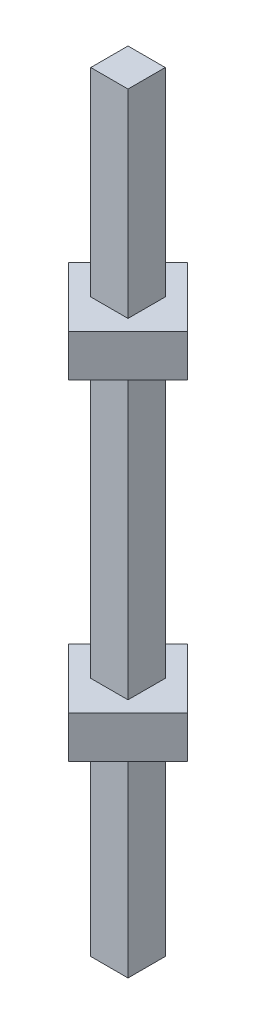
from build123d import *

# Parameters (mm, degrees)
SKETCH_1_W      = 15
SKETCH_1_H      = 15
EXTRUDE_1_DEPTH = 310
EXTRUDE_3_DEPTH = 17
EXTRUDE_4_DEPTH = 17


with BuildPart() as part:
    # 草图1 → 凸台-拉伸1 (new body)
    with BuildSketch(Plane(origin=(0, 0, 0), x_dir=(1, 0, 0), z_dir=(0, 1, 0))):
        with Locations((7.5, 7.5)):
            Rectangle(SKETCH_1_W, SKETCH_1_H)
    extrude(amount=EXTRUDE_1_DEPTH)

    # 草图3 → 凸台-拉伸3 (add)
    with BuildSketch(Plane(origin=(0, 80, 0), x_dir=(-1, 0, 0), z_dir=(0, -1, 0))):
        Polygon((-7.5, 31.54163056), (-31.54163056, 7.5), (-7.5, -16.54163056), (16.54163056, 7.5), align=None)
    extrude(amount=-EXTRUDE_3_DEPTH)

    # 草图4 → 凸台-拉伸4 (add)
    with BuildSketch(Plane(origin=(0, 230, 0), x_dir=(1, 0, 0), z_dir=(0, 1, 0))):
        Polygon((7.5, 31.54163056), (-16.54163056, 7.5), (7.5, -16.54163056), (31.54163056, 7.5), align=None)
    extrude(amount=-EXTRUDE_4_DEPTH)


solid = part.part
